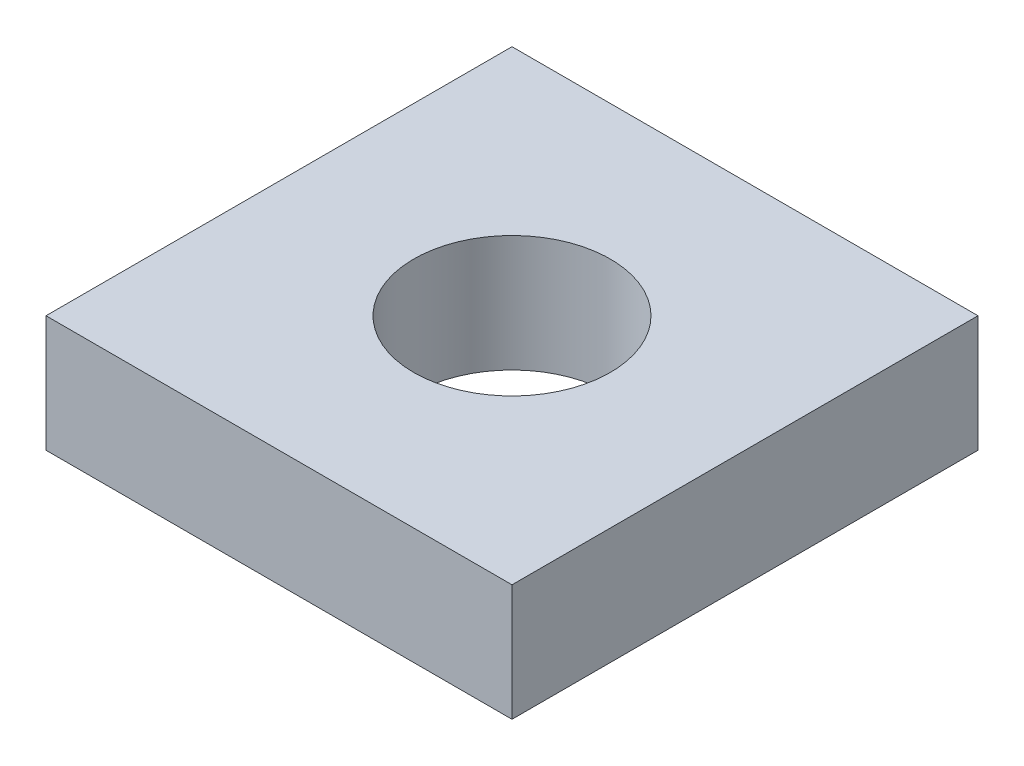
from build123d import *

# Parameters (mm, degrees)
SKETCH1_W           = 25.4
SKETCH1_H           = 25.4
SKETCH1_R           = 5.3578125
BOSS_EXTRUDE1_DEPTH = 6.35


with BuildPart() as part:
    # Sketch1 → Boss-Extrude1 (new body)
    with BuildSketch(Plane(origin=(0, 0, 0), x_dir=(1, 0, 0), z_dir=(0, 1, 0))):
        Rectangle(SKETCH1_W, SKETCH1_H)
        with Locations(Location((0, 0, 0), (0, 0, 270))):
            Circle(SKETCH1_R, mode=Mode.SUBTRACT)
    extrude(amount=BOSS_EXTRUDE1_DEPTH)


solid = part.part
